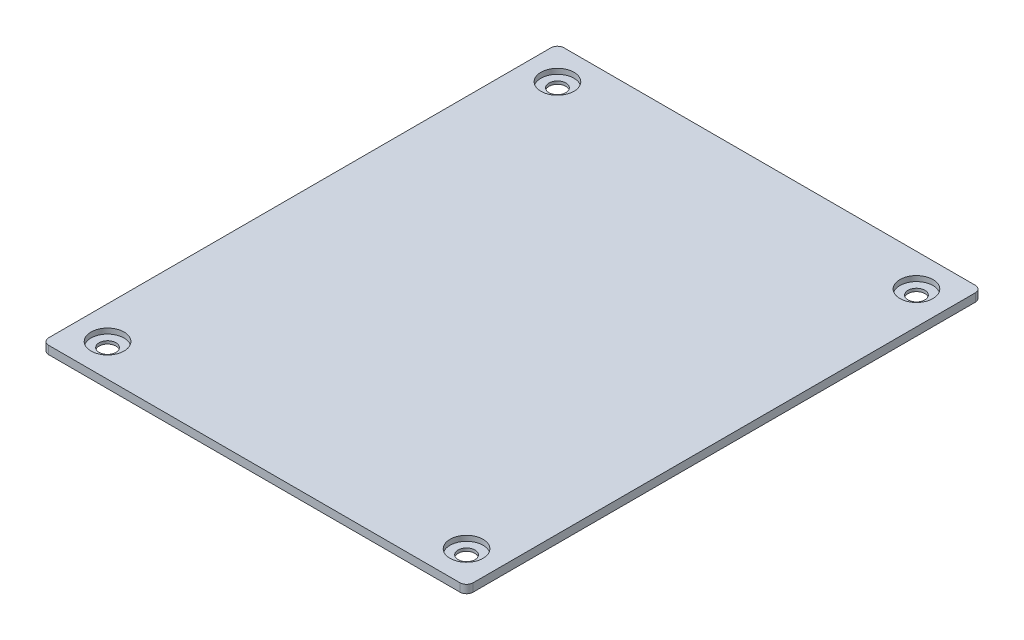
from build123d import *

# Parameters (mm, degrees)
SKETCH1_W                                        = 164.846
SKETCH1_H                                        = 200.152
BOSS_EXTRUDE1_DEPTH                              = 3.175
CBORE_FOR_1_4_SOCKET_HEAD_CAP_SCREW1_D           = 6.5278
CBORE_FOR_1_4_SOCKET_HEAD_CAP_SCREW1_CBORE_D     = 12.827
CBORE_FOR_1_4_SOCKET_HEAD_CAP_SCREW1_CBORE_DEPTH = 2.032
FILLET1_R                                        = 2.54


with BuildPart() as part:
    # Sketch1 → Boss-Extrude1 (new body)
    with BuildSketch(Plane(origin=(0, 0, 0), x_dir=(1, 0, 0), z_dir=(0, 1, 0))):
        Rectangle(SKETCH1_W, SKETCH1_H)
    extrude(amount=BOSS_EXTRUDE1_DEPTH)

    # CBORE for 1/4 Socket Head Cap Screw1 (through all)
    with Locations(Plane(origin=(0, 3.175, 0), x_dir=(-1, 0, 0), z_dir=(0, 1, 0))):
        with Locations((69.723, 87.376), (69.723, -87.376), (-69.723, 87.376), (-69.723, -87.376)):
            CounterBoreHole(CBORE_FOR_1_4_SOCKET_HEAD_CAP_SCREW1_D / 2, CBORE_FOR_1_4_SOCKET_HEAD_CAP_SCREW1_CBORE_D / 2, CBORE_FOR_1_4_SOCKET_HEAD_CAP_SCREW1_CBORE_DEPTH)

    # Fillet1
    fillet1_edges = [part.edges().sort_by_distance(p)[0] for p in [
        (82.423, 1.5875, 100.076),
        (-82.423, 1.5875, 100.076),
        (-82.423, 1.5875, -100.076),
        (82.423, 1.5875, -100.076),
    ]]
    fillet(fillet1_edges, radius=FILLET1_R)


solid = part.part
